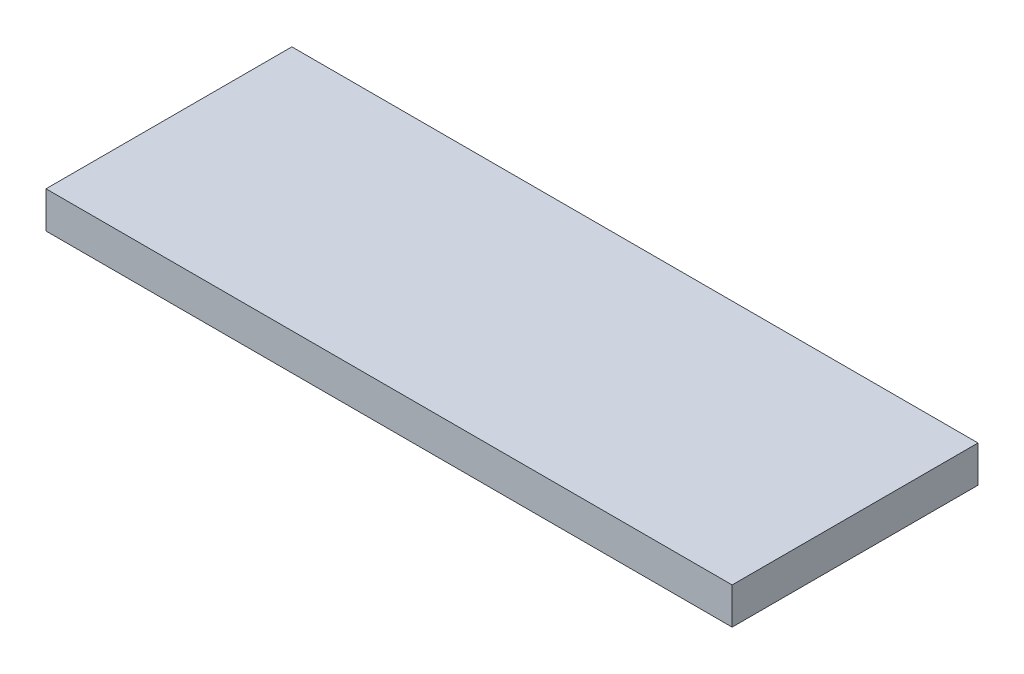
from build123d import *

# Parameters (mm, degrees)
SKETCH2_W           = 30
SKETCH2_H           = 10.75
BOSS_EXTRUDE1_DEPTH = 1.6


with BuildPart() as part:
    # Sketch2 → Boss-Extrude1 (new body)
    with BuildSketch(Plane(origin=(0, 0, 0), x_dir=(1, 0, 0), z_dir=(0, 1, 0))):
        with Locations((15, 5.375)):
            Rectangle(SKETCH2_W, SKETCH2_H)
    extrude(amount=BOSS_EXTRUDE1_DEPTH)


solid = part.part
